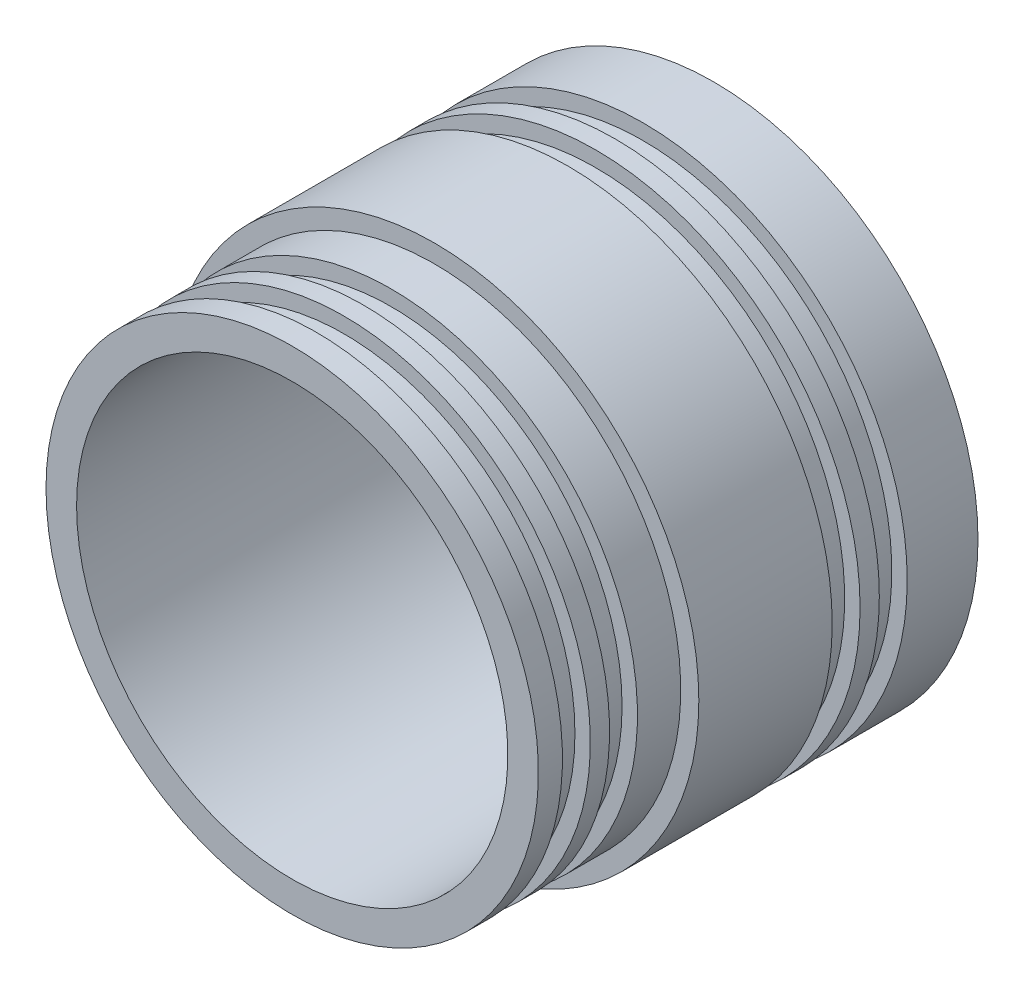
from build123d import *


with BuildPart() as part:
    # Sketch1 → Revolve1 (O-Rings : 2-141 & 2-144) (revolve)
    with BuildSketch(Plane(origin=(0, 0, 0), x_dir=(0, 0, -1), z_dir=(1, 0, 0)), mode=Mode.PRIVATE) as revolve1_o_rings_2_141_2_144_sk:
        Polygon((0, 28.4734), (0, 32.8676), (6.1722, 32.8676), (6.1722, 34.8996), (-3.175, 34.8996), (-3.175, 32.8676), (-6.858, 32.8676), (-6.858, 34.8996), (-9.398, 34.8996), (-9.398, 32.8676), (-13.081, 32.8676), (-13.081, 34.8996), (-30.69336, 34.8996), (-30.69336, 32.512), (-36.40836, 32.512), (-36.40836, 30.48), (-40.09136, 30.48), (-40.09136, 32.512), (-42.63136, 32.512), (-42.63136, 30.48), (-46.31436, 30.48), (-46.31436, 32.512), (-49.48936, 32.512), (-49.48936, 28.4734), align=None)
    revolve(revolve1_o_rings_2_141_2_144_sk.sketch.rotate(Axis((0, 0, 0), (0, 0, 1)), 90), axis=Axis((0, 0, 0), (0, 0, 1)))


solid = part.part
